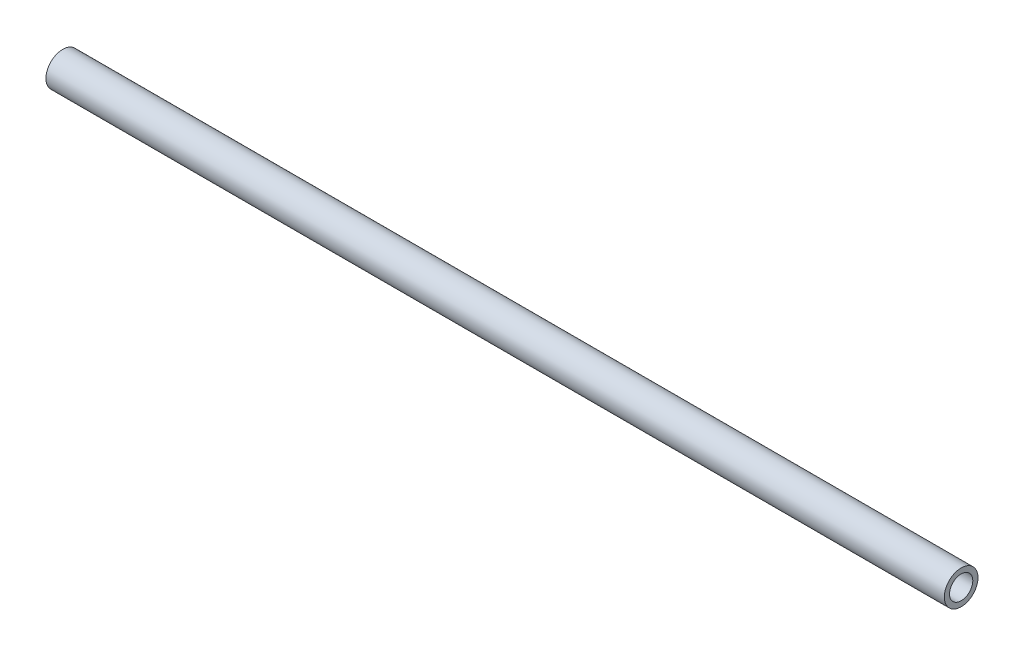
from build123d import *

# Parameters (mm, degrees)
SKETCH3_R           = 4.7625
SKETCH3_R_2         = 3.2893
BOSS_EXTRUDE1_DEPTH = 127


with BuildPart() as part:
    # Sketch3 → Boss-Extrude1 (new, symmetric)
    with BuildSketch(Plane(origin=(0, 0, 0), x_dir=(0, 0, -1), z_dir=(1, 0, 0))):
        Circle(SKETCH3_R)
        Circle(SKETCH3_R_2, mode=Mode.SUBTRACT)
    extrude(amount=BOSS_EXTRUDE1_DEPTH, both=True)


solid = part.part
